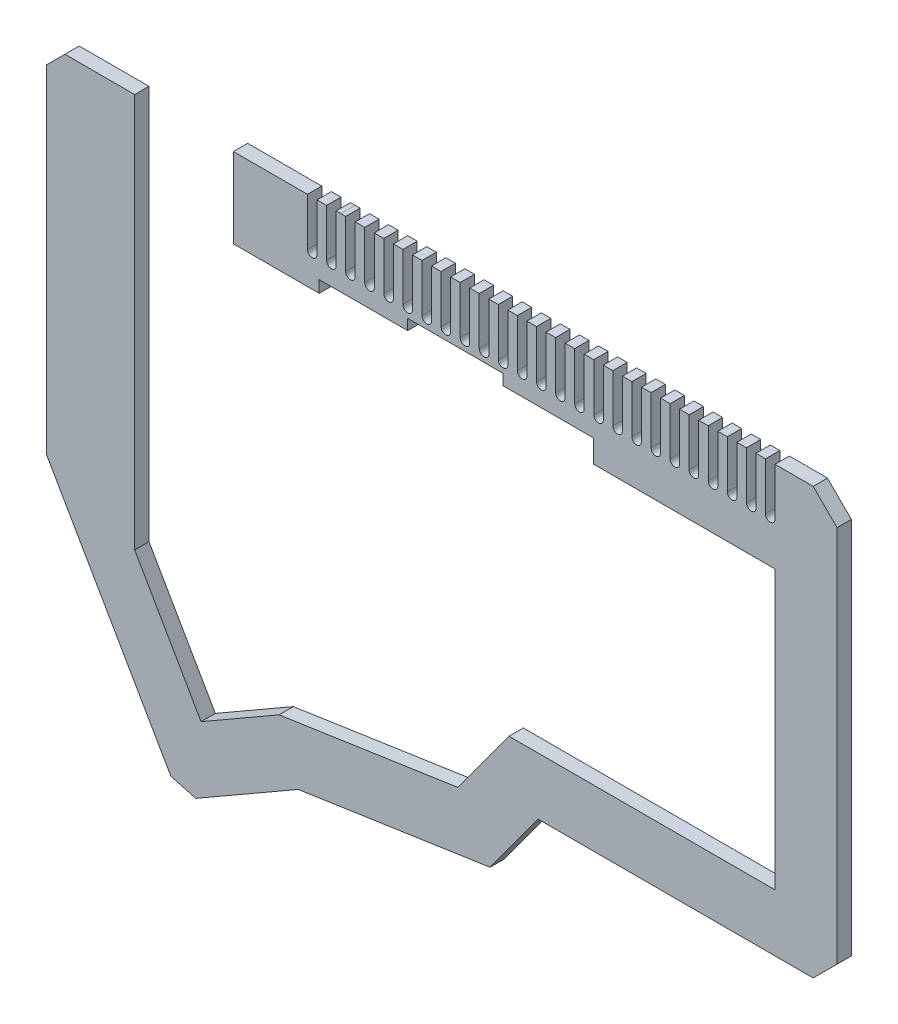
from build123d import *

# Parameters (mm, degrees)
BOSS_EXTRU_1_DEPTH = 3


with BuildPart() as part:
    # Esquisse1 → Boss.-Extru.1 (new body)
    with BuildSketch(Plane.XY):
        with BuildLine():
            Line((-119.34630187, 4.320852512), (-119.346382005, -12.429484403))
            Line((-119.346382005, -12.429484403), (-101.345774335, -12.429484403))
            Line((-101.345774335, -12.429484403), (-101.345774335, -9.929307079))
            Line((-101.345774335, -9.929307079), (-82.803225752, -9.929307079))
            Line((-82.803225752, -9.929307079), (-82.803225752, -7.679926158))
            Line((-82.803225752, -7.679926158), (-62.801949021, -7.681038584))
            Line((-62.801949021, -7.681038584), (-62.801949021, -9.929307079))
            Line((-62.801949021, -9.929307079), (-43.80060136, -9.929307079))
            Line((-43.80060136, -9.929307079), (-43.80060136, -14.679643994))
            Line((-43.80060136, -14.679643994), (-5.797906039, -14.679643994))
            Line((-5.797906039, -14.679643994), (-5.797906039, -72.933633781))
            Line((-5.797906039, -72.933633781), (-61.577157206, -72.933633781))
            Line((-61.577157206, -72.933633781), (-72.263087593, -87.572177036))
            Line((-72.263087593, -87.572177036), (-109.761976756, -93.1463556))
            Line((-109.761976756, -93.1463556), (-126.111124489, -102.556497988))
            Line((-126.111124489, -102.556497988), (-140.02282508, -78.342807898))
            Line((-140.02282508, -78.342807898), (-140.02282508, 4.320852512))
            Line((-140.02282508, 4.320852512), (-142.02282508, 4.320852512))
            Line((-142.02282508, 4.320852512), (-154.65055875, 4.320852512))
            Line((-154.65055875, 4.320852512), (-158.478985875, 0.492425388))
            Line((-158.478985875, 0.492425388), (-158.478985875, -3.429484403))
            Line((-158.478985875, -3.429484403), (-158.478985875, -70.307502815))
            Line((-158.478985875, -70.307502815), (-132.440036759, -115.628996046))
            Line((-132.440036759, -115.628996046), (-127.216265437, -117.03834868))
            Line((-127.216265437, -117.03834868), (-105.747438988, -104.681452952))
            Line((-105.747438988, -104.681452952), (-65.531582138, -98.70339941))
            Line((-65.531582138, -98.70339941), (-55.479847181, -84.933633781))
            Line((-55.479847181, -84.933633781), (2.202093961, -84.933633781))
            Line((2.202093961, -84.933633781), (7.202093961, -79.933633781))
            Line((7.202093961, -79.933633781), (7.202093961, -0.684932032))
            Line((7.202093961, -0.684932032), (2.202093969, 4.315346056))
            Line((2.202093969, 4.315346056), (-5.797906039, 4.315790998))
            Line((-5.797906039, 4.315790998), (-5.797906039, -5.684153384))
            ThreePointArc((-5.797906039, -5.684153384), (-6.797906039, -6.684153384), (-7.797906039, -5.684153384))
            Line((-7.797906039, -5.684153384), (-7.797906039, 4.315902234))
            Line((-7.797906039, 4.315902234), (-9.797906039, 4.316013469))
            Line((-9.797906039, 4.316013469), (-9.797906039, -5.684153384))
            ThreePointArc((-9.797906039, -5.684153384), (-10.797906039, -6.684153384), (-11.797906039, -5.684153384))
            Line((-11.797906039, -5.684153384), (-11.797906039, 4.316124705))
            Line((-11.797906039, 4.316124705), (-13.797906039, 4.31623594))
            Line((-13.797906039, 4.31623594), (-13.797906039, -5.684153384))
            ThreePointArc((-13.797906039, -5.684153384), (-14.797906039, -6.684153384), (-15.797906039, -5.684153384))
            Line((-15.797906039, -5.684153384), (-15.797906039, 4.316347176))
            Line((-15.797906039, 4.316347176), (-17.797906039, 4.316458411))
            Line((-17.797906039, 4.316458411), (-17.797906039, -5.684153384))
            ThreePointArc((-17.797906039, -5.684153384), (-18.797906039, -6.684153384), (-19.797906039, -5.684153384))
            Line((-19.797906039, -5.684153384), (-19.797906039, 4.316569647))
            Line((-19.797906039, 4.316569647), (-21.797906039, 4.316680882))
            Line((-21.797906039, 4.316680882), (-21.797906039, -5.684153384))
            ThreePointArc((-21.797906039, -5.684153384), (-22.797906039, -6.684153384), (-23.797906039, -5.684153384))
            Line((-23.797906039, -5.684153384), (-23.797906039, 4.316792118))
            Line((-23.797906039, 4.316792118), (-25.797906039, 4.316903353))
            Line((-25.797906039, 4.316903353), (-25.797906039, -5.684153384))
            ThreePointArc((-25.797906039, -5.684153384), (-26.797906039, -6.684153384), (-27.797906039, -5.684153384))
            Line((-27.797906039, -5.684153384), (-27.797906039, 4.317014589))
            Line((-27.797906039, 4.317014589), (-29.797906039, 4.317125824))
            Line((-29.797906039, 4.317125824), (-29.797906039, -5.684153384))
            ThreePointArc((-29.797906039, -5.684153384), (-30.797906039, -6.684153384), (-31.797906039, -5.684153384))
            Line((-31.797906039, -5.684153384), (-31.797906039, 4.31723706))
            Line((-31.797906039, 4.31723706), (-33.797906039, 4.317348295))
            Line((-33.797906039, 4.317348295), (-33.797906039, -5.684153384))
            ThreePointArc((-33.797906039, -5.684153384), (-34.797906039, -6.684153384), (-35.797906039, -5.684153384))
            Line((-35.797906039, -5.684153384), (-35.797906039, 4.317459531))
            Line((-35.797906039, 4.317459531), (-37.797906039, 4.317570766))
            Line((-37.797906039, 4.317570766), (-37.797906039, -5.684153384))
            ThreePointArc((-37.797906039, -5.684153384), (-38.797906039, -6.684153384), (-39.797906039, -5.684153384))
            Line((-39.797906039, -5.684153384), (-39.797906039, 4.317682002))
            Line((-39.797906039, 4.317682002), (-41.797906039, 4.317793237))
            Line((-41.797906039, 4.317793237), (-41.797906039, -5.684153384))
            ThreePointArc((-41.797906039, -5.684153384), (-42.797906039, -6.684153384), (-43.797906039, -5.684153384))
            Line((-43.797906039, -5.684153384), (-43.797906039, 4.317904473))
            Line((-43.797906039, 4.317904473), (-45.797906039, 4.318015708))
            Line((-45.797906039, 4.318015708), (-45.797906039, -5.684153384))
            ThreePointArc((-45.797906039, -5.684153384), (-46.797906039, -6.684153384), (-47.797906039, -5.684153384))
            Line((-47.797906039, -5.684153384), (-47.797906039, 4.318126944))
            Line((-47.797906039, 4.318126944), (-49.797906039, 4.318238179))
            Line((-49.797906039, 4.318238179), (-49.797906039, -5.684153384))
            ThreePointArc((-49.797906039, -5.684153384), (-50.797906039, -6.684153384), (-51.797906039, -5.684153384))
            Line((-51.797906039, -5.684153384), (-51.797906039, 4.318349415))
            Line((-51.797906039, 4.318349415), (-53.797906039, 4.31846065))
            Line((-53.797906039, 4.31846065), (-53.797906039, -5.684153384))
            ThreePointArc((-53.797906039, -5.684153384), (-54.797906039, -6.684153384), (-55.797906039, -5.684153384))
            Line((-55.797906039, -5.684153384), (-55.797906039, 4.318571886))
            Line((-55.797906039, 4.318571886), (-57.797906039, 4.318683121))
            Line((-57.797906039, 4.318683121), (-57.797906039, -5.684153384))
            ThreePointArc((-57.797906039, -5.684153384), (-58.797906039, -6.684153384), (-59.797906039, -5.684153384))
            Line((-59.797906039, -5.684153384), (-59.797906039, 4.318794357))
            Line((-59.797906039, 4.318794357), (-61.797906039, 4.318905592))
            Line((-61.797906039, 4.318905592), (-61.797906039, -5.684153384))
            ThreePointArc((-61.797906039, -5.684153384), (-62.797906039, -6.684153384), (-63.797906039, -5.684153384))
            Line((-63.797906039, -5.684153384), (-63.797906039, 4.319016828))
            Line((-63.797906039, 4.319016828), (-65.797906039, 4.319128063))
            Line((-65.797906039, 4.319128063), (-65.797906039, -5.684153384))
            ThreePointArc((-65.797906039, -5.684153384), (-66.797906039, -6.684153384), (-67.797906039, -5.684153384))
            Line((-67.797906039, -5.684153384), (-67.797906039, 4.319239299))
            Line((-67.797906039, 4.319239299), (-69.797906039, 4.319350534))
            Line((-69.797906039, 4.319350534), (-69.797906039, -5.684153384))
            ThreePointArc((-69.797906039, -5.684153384), (-70.797906039, -6.684153384), (-71.797906039, -5.684153384))
            Line((-71.797906039, -5.684153384), (-71.797906039, 4.31946177))
            Line((-71.797906039, 4.31946177), (-73.797906039, 4.319573005))
            Line((-73.797906039, 4.319573005), (-73.797906039, -5.684153384))
            ThreePointArc((-73.797906039, -5.684153384), (-74.797906039, -6.684153384), (-75.797906039, -5.684153384))
            Line((-75.797906039, -5.684153384), (-75.797906039, 4.319684241))
            Line((-75.797906039, 4.319684241), (-77.797906039, 4.319795476))
            Line((-77.797906039, 4.319795476), (-77.797906039, -5.684153384))
            ThreePointArc((-77.797906039, -5.684153384), (-78.797906039, -6.684153384), (-79.797906039, -5.684153384))
            Line((-79.797906039, -5.684153384), (-79.797906039, 4.319906712))
            Line((-79.797906039, 4.319906712), (-81.797906039, 4.320017947))
            Line((-81.797906039, 4.320017947), (-81.797906039, -5.684153384))
            ThreePointArc((-81.797906039, -5.684153384), (-82.797906039, -6.684153384), (-83.797906039, -5.684153384))
            Line((-83.797906039, -5.684153384), (-83.797906039, 4.320129183))
            Line((-83.797906039, 4.320129183), (-85.797906039, 4.320240418))
            Line((-85.797906039, 4.320240418), (-85.797906039, -5.684153384))
            ThreePointArc((-85.797906039, -5.684153384), (-86.797906039, -6.684153384), (-87.797906039, -5.684153384))
            Line((-87.797906039, -5.684153384), (-87.797906039, 4.320351654))
            Line((-87.797906039, 4.320351654), (-89.797906039, 4.320462889))
            Line((-89.797906039, 4.320462889), (-89.797906039, -5.684153384))
            ThreePointArc((-89.797906039, -5.684153384), (-90.797906039, -6.684153384), (-91.797906039, -5.684153384))
            Line((-91.797906039, -5.684153384), (-91.797906039, 4.320574125))
            Line((-91.797906039, 4.320574125), (-93.797906039, 4.32068536))
            Line((-93.797906039, 4.32068536), (-93.797906039, -5.684153384))
            ThreePointArc((-93.797906039, -5.684153384), (-94.797906039, -6.684153384), (-95.797906039, -5.684153384))
            Line((-95.797906039, -5.684153384), (-95.797906039, 4.320796596))
            Line((-95.797906039, 4.320796596), (-96.80328137, 4.320852512))
            Line((-96.80328137, 4.320852512), (-97.797906039, 4.320852512))
            Line((-97.797906039, 4.320852512), (-97.797906039, -5.684153384))
            ThreePointArc((-97.797906039, -5.684153384), (-98.797906039, -6.684153384), (-99.797906039, -5.684153384))
            Line((-99.797906039, -5.684153384), (-99.797906039, 4.320852512))
            Line((-99.797906039, 4.320852512), (-101.797906039, 4.320852512))
            Line((-101.797906039, 4.320852512), (-101.797906039, -5.684153384))
            ThreePointArc((-101.797906039, -5.684153384), (-102.797906039, -6.684153384), (-103.797906039, -5.684153384))
            Line((-103.797906039, -5.684153384), (-103.797906039, 4.320852512))
            Line((-103.797906039, 4.320852512), (-103.799739609, 4.320852512))
            Line((-103.799739609, 4.320852512), (-117.346315028, 4.320852512))
            Line((-117.346315028, 4.320852512), (-119.34630187, 4.320852512))
        make_face()
    extrude(amount=BOSS_EXTRU_1_DEPTH)


solid = part.part
